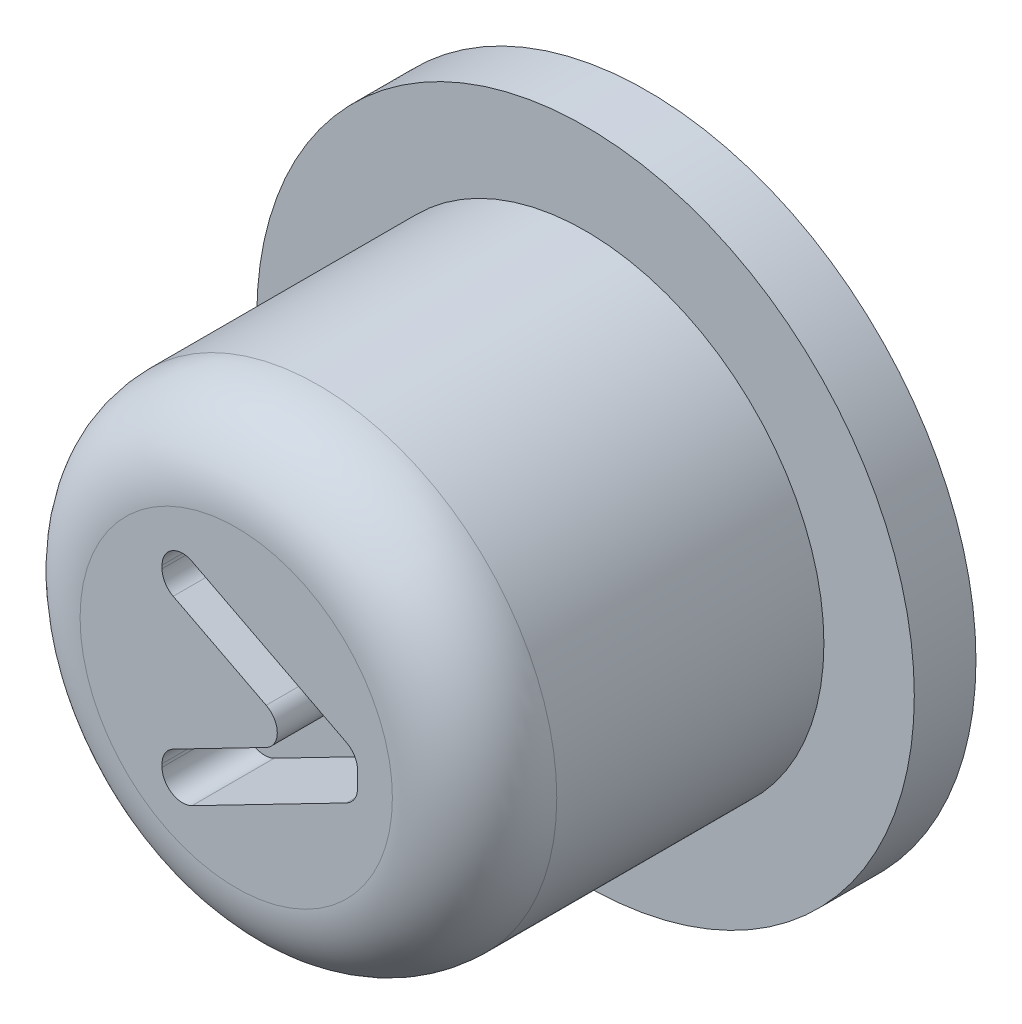
from build123d import *

# Parameters (mm, degrees)
SZKIC1_R                    = 4
DODANIE_WYCI_GNI_CIE1_DEPTH = 0.75
SZKIC2_R                    = 2.9
DODANIE_WYCI_GNI_CIE2_DEPTH = 4.25
SZKIC3_W                    = 2.5
SZKIC3_H                    = 2.5
WYTNIJ_WYCI_GNI_CIE1_DEPTH  = 1
ZAOKR_GLENIE2_R             = 1
SZKIC4_W                    = 2.9
SZKIC4_H                    = 2.9
WYTNIJ_WYCI_GNI_CIE2_DEPTH  = 1
WYTNIJ_WYCI_GNI_CIE3_DEPTH  = 1
ZAOKR_GLENIE3_R             = 0.25


with BuildPart() as part:
    # Szkic1 → Dodanie-wyciągnięcie1 (new body)
    with BuildSketch(Plane.XY):
        Circle(SZKIC1_R)
    extrude(amount=DODANIE_WYCI_GNI_CIE1_DEPTH)

    # Szkic2 → Dodanie-wyciągnięcie2 (add)
    with BuildSketch(Plane.XY.offset(0.75)):
        Circle(SZKIC2_R)
    extrude(amount=DODANIE_WYCI_GNI_CIE2_DEPTH)

    # Szkic3 → Wytnij-wyciągnięcie1 (cut)
    with BuildSketch(Plane(origin=(0, 0, 0), x_dir=(-1, 0, 0), z_dir=(0, 0, -1))):
        Rectangle(SZKIC3_W, SZKIC3_H)
    extrude(amount=-WYTNIJ_WYCI_GNI_CIE1_DEPTH, mode=Mode.SUBTRACT)

    # Zaokrąglenie2
    zaokr_glenie2_edges = [part.edges().sort_by_distance(p)[0] for p in [
        (-2.9, 0, 5),
    ]]
    fillet(zaokr_glenie2_edges, radius=ZAOKR_GLENIE2_R)

    # Szkic4 → Wytnij-wyciągnięcie2 (cut)
    with BuildSketch(Plane(origin=(0, 0, 0), x_dir=(-1, 0, 0), z_dir=(0, 0, -1))):
        Rectangle(SZKIC4_W, SZKIC4_H)
    extrude(amount=-WYTNIJ_WYCI_GNI_CIE2_DEPTH, mode=Mode.SUBTRACT)

    # Szkic5 → Wytnij-wyciągnięcie3 (cut)
    with BuildSketch(Plane.XY.offset(5)):
        Polygon((-0.902184432, 0.860277554), (-0.902184432, 1.46043781), (1.476020697, 0.234175791), (1.476020697, -0.263620684), (-0.902184432, -1.489181581), (-0.902184432, -0.889722446), (0.795231434, -0.014722446), align=None)
    extrude(amount=-WYTNIJ_WYCI_GNI_CIE3_DEPTH, mode=Mode.SUBTRACT)

    # Zaokrąglenie3
    zaokr_glenie3_edges = [part.edges().sort_by_distance(p)[0] for p in [
        (0.795231434, -0.014722446, 4.5),
        (-0.902184432, 0.860277554, 4.5),
        (-0.902184432, 1.46043781, 4.5),
        (1.476020697, 0.234175791, 4.5),
        (1.476020697, -0.263620684, 4.5),
        (-0.902184432, -1.489181581, 4.5),
        (-0.902184432, -0.889722446, 4.5),
    ]]
    fillet(zaokr_glenie3_edges, radius=ZAOKR_GLENIE3_R)


solid = part.part
